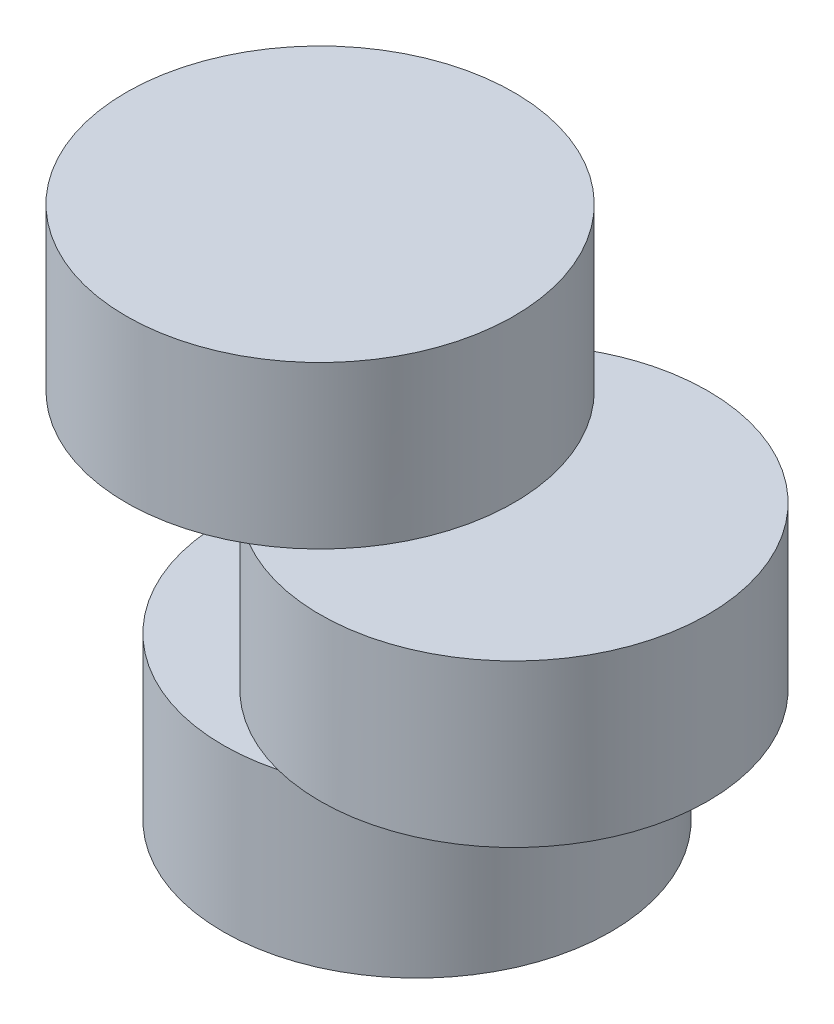
from build123d import *

# Parameters (mm, degrees)
SKETCH1_R           = 12
BOSS_EXTRUDE1_DEPTH = 10
SKETCH2_R           = 12
BOSS_EXTRUDE2_DEPTH = 10
SKETCH3_R           = 12
BOSS_EXTRUDE3_DEPTH = 10
CUT_EXTRUDE1_DEPTH  = 6


with BuildPart() as part:
    # Sketch1 → Boss-Extrude1 (new body)
    with BuildSketch(Plane(origin=(0, 0, 0), x_dir=(1, 0, 0), z_dir=(0, 1, 0))):
        with Locations(Location((0, 0, 0), (0, 0, 270))):
            Circle(SKETCH1_R)
    extrude(amount=BOSS_EXTRUDE1_DEPTH)

    # Sketch2 → Boss-Extrude2 (add)
    with BuildSketch(Plane(origin=(0, 10, 0), x_dir=(1, 0, 0), z_dir=(0, 1, 0))):
        with Locations(Location((6, 0, 0), (0, 0, 104.477512186))):
            Circle(SKETCH2_R)
    extrude(amount=BOSS_EXTRUDE2_DEPTH)

    # Sketch3 → Boss-Extrude3 (add)
    with BuildSketch(Plane(origin=(0, 20, 0), x_dir=(1, 0, 0), z_dir=(0, 1, 0))):
        with Locations(Location((-6, 0, 0), (0, 0, 60))):
            Circle(SKETCH3_R)
    extrude(amount=BOSS_EXTRUDE3_DEPTH)

    # Sketch4 → Cut-Extrude1 (cut)
    with BuildSketch(Plane.XZ):
        with BuildLine():
            Line((-2.180114967, -2.060849032), (-2.180114967, 2.060849032))
            ThreePointArc((-2.180114967, 2.060849032), (3, 0), (-2.180114967, -2.060849032))
        make_face()
    extrude(amount=-CUT_EXTRUDE1_DEPTH, mode=Mode.SUBTRACT)


solid = part.part
